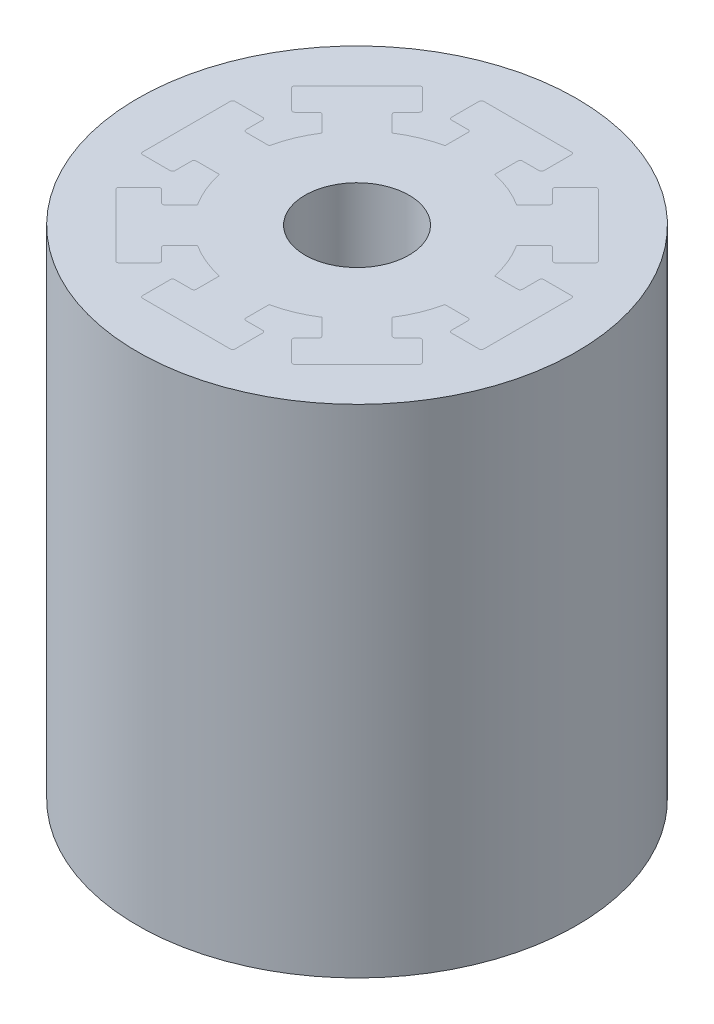
from build123d import *

# Parameters (mm, degrees)
SKETCH1_R           = 4.5
BOSS_EXTRUDE1_DEPTH = 43
SKETCH2_R           = 19
BOSS_EXTRUDE2_DEPTH = 43


with BuildPart() as part:
    # Sketch1 → Boss-Extrude1 (new body)
    with BuildSketch(Plane(origin=(0, 0, 0), x_dir=(1, 0, 0), z_dir=(0, 1, 0))):
        with BuildLine():
            Line((-2.15, 11.766140486), (-2.15, 9.766140486))
            ThreePointArc((-2.15, 9.766140486), (-3.826834324, 9.238795325), (-5.385424584, 8.425983744))
            Line((-5.385424584, 8.425983744), (-6.799638147, 9.840197306))
            ThreePointArc((-6.799638147, 9.840197306), (-6.858216791, 9.981618662), (-6.799638147, 10.123040018))
            Line((-6.799638147, 10.123040018), (-5.774333314, 11.148344851))
            ThreePointArc((-5.774333314, 11.148344851), (-5.71575467, 11.289766207), (-5.774333314, 11.431187564))
            Line((-5.774333314, 11.431187564), (-7.471389589, 13.128243838))
            ThreePointArc((-7.471389589, 13.128243838), (-7.612810945, 13.186822482), (-7.754232301, 13.128243838))
            Line((-7.754232301, 13.128243838), (-13.128243838, 7.754232301))
            ThreePointArc((-13.128243838, 7.754232301), (-13.186822482, 7.612810945), (-13.128243838, 7.471389589))
            Line((-13.128243838, 7.471389589), (-11.431187564, 5.774333314))
            ThreePointArc((-11.431187564, 5.774333314), (-11.289766207, 5.71575467), (-11.148344851, 5.774333314))
            Line((-11.148344851, 5.774333314), (-10.123040018, 6.799638147))
            ThreePointArc((-10.123040018, 6.799638147), (-9.981618662, 6.858216791), (-9.840197306, 6.799638147))
            Line((-9.840197306, 6.799638147), (-8.425983744, 5.385424584))
            ThreePointArc((-8.425983744, 5.385424584), (-9.238795325, 3.826834324), (-9.766140486, 2.15))
            Line((-9.766140486, 2.15), (-11.766140486, 2.15))
            ThreePointArc((-11.766140486, 2.15), (-11.907561843, 2.208578644), (-11.966140486, 2.35))
            Line((-11.966140486, 2.35), (-11.966140486, 3.8))
            ThreePointArc((-11.966140486, 3.8), (-12.02471913, 3.941421356), (-12.166140486, 4))
            Line((-12.166140486, 4), (-14.566140486, 4))
            ThreePointArc((-14.566140486, 4), (-14.707561843, 3.941421356), (-14.766140486, 3.8))
            Line((-14.766140486, 3.8), (-14.766140486, -3.8))
            ThreePointArc((-14.766140486, -3.8), (-14.707561843, -3.941421356), (-14.566140486, -4))
            Line((-14.566140486, -4), (-12.166140486, -4))
            ThreePointArc((-12.166140486, -4), (-12.02471913, -3.941421356), (-11.966140486, -3.8))
            Line((-11.966140486, -3.8), (-11.966140486, -2.35))
            ThreePointArc((-11.966140486, -2.35), (-11.907561843, -2.208578644), (-11.766140486, -2.15))
            Line((-11.766140486, -2.15), (-9.766140486, -2.15))
            ThreePointArc((-9.766140486, -2.15), (-9.238795325, -3.826834324), (-8.425983744, -5.385424584))
            Line((-8.425983744, -5.385424584), (-9.840197306, -6.799638147))
            ThreePointArc((-9.840197306, -6.799638147), (-9.981618662, -6.858216791), (-10.123040018, -6.799638147))
            Line((-10.123040018, -6.799638147), (-11.148344851, -5.774333314))
            ThreePointArc((-11.148344851, -5.774333314), (-11.289766207, -5.71575467), (-11.431187564, -5.774333314))
            Line((-11.431187564, -5.774333314), (-13.128243838, -7.471389589))
            ThreePointArc((-13.128243838, -7.471389589), (-13.186822482, -7.612810945), (-13.128243838, -7.754232301))
            Line((-13.128243838, -7.754232301), (-7.754232301, -13.128243838))
            ThreePointArc((-7.754232301, -13.128243838), (-7.612810945, -13.186822482), (-7.471389589, -13.128243838))
            Line((-7.471389589, -13.128243838), (-5.774333314, -11.431187564))
            ThreePointArc((-5.774333314, -11.431187564), (-5.71575467, -11.289766207), (-5.774333314, -11.148344851))
            Line((-5.774333314, -11.148344851), (-6.799638147, -10.123040018))
            ThreePointArc((-6.799638147, -10.123040018), (-6.858216791, -9.981618662), (-6.799638147, -9.840197306))
            Line((-6.799638147, -9.840197306), (-5.385424584, -8.425983744))
            ThreePointArc((-5.385424584, -8.425983744), (-3.826834324, -9.238795325), (-2.15, -9.766140486))
            Line((-2.15, -9.766140486), (-2.15, -11.766140486))
            ThreePointArc((-2.15, -11.766140486), (-2.208578644, -11.907561843), (-2.35, -11.966140486))
            Line((-2.35, -11.966140486), (-3.8, -11.966140486))
            ThreePointArc((-3.8, -11.966140486), (-3.941421356, -12.02471913), (-4, -12.166140486))
            Line((-4, -12.166140486), (-4, -14.566140486))
            ThreePointArc((-4, -14.566140486), (-3.941421356, -14.707561843), (-3.8, -14.766140486))
            Line((-3.8, -14.766140486), (3.8, -14.766140486))
            ThreePointArc((3.8, -14.766140486), (3.941421356, -14.707561843), (4, -14.566140486))
            Line((4, -14.566140486), (4, -12.166140486))
            ThreePointArc((4, -12.166140486), (3.941421356, -12.02471913), (3.8, -11.966140486))
            Line((3.8, -11.966140486), (2.35, -11.966140486))
            ThreePointArc((2.35, -11.966140486), (2.208578644, -11.907561843), (2.15, -11.766140486))
            Line((2.15, -11.766140486), (2.15, -9.766140486))
            ThreePointArc((2.15, -9.766140486), (3.826834324, -9.238795325), (5.385424584, -8.425983744))
            Line((5.385424584, -8.425983744), (6.799638147, -9.840197306))
            ThreePointArc((6.799638147, -9.840197306), (6.858216791, -9.981618662), (6.799638147, -10.123040018))
            Line((6.799638147, -10.123040018), (5.774333314, -11.148344851))
            ThreePointArc((5.774333314, -11.148344851), (5.71575467, -11.289766207), (5.774333314, -11.431187564))
            Line((5.774333314, -11.431187564), (7.471389589, -13.128243838))
            ThreePointArc((7.471389589, -13.128243838), (7.612810945, -13.186822482), (7.754232301, -13.128243838))
            Line((7.754232301, -13.128243838), (13.128243838, -7.754232301))
            ThreePointArc((13.128243838, -7.754232301), (13.186822482, -7.612810945), (13.128243838, -7.471389589))
            Line((13.128243838, -7.471389589), (11.431187564, -5.774333314))
            ThreePointArc((11.431187564, -5.774333314), (11.289766207, -5.71575467), (11.148344851, -5.774333314))
            Line((11.148344851, -5.774333314), (10.123040018, -6.799638147))
            ThreePointArc((10.123040018, -6.799638147), (9.981618662, -6.858216791), (9.840197306, -6.799638147))
            Line((9.840197306, -6.799638147), (8.425983744, -5.385424584))
            ThreePointArc((8.425983744, -5.385424584), (9.238795325, -3.826834324), (9.766140486, -2.15))
            Line((9.766140486, -2.15), (11.766140486, -2.15))
            ThreePointArc((11.766140486, -2.15), (11.907561843, -2.208578644), (11.966140486, -2.35))
            Line((11.966140486, -2.35), (11.966140486, -3.8))
            ThreePointArc((11.966140486, -3.8), (12.02471913, -3.941421356), (12.166140486, -4))
            Line((12.166140486, -4), (14.566140486, -4))
            ThreePointArc((14.566140486, -4), (14.707561843, -3.941421356), (14.766140486, -3.8))
            Line((14.766140486, -3.8), (14.766140486, 3.8))
            ThreePointArc((14.766140486, 3.8), (14.707561843, 3.941421356), (14.566140486, 4))
            Line((14.566140486, 4), (12.166140486, 4))
            ThreePointArc((12.166140486, 4), (12.02471913, 3.941421356), (11.966140486, 3.8))
            Line((11.966140486, 3.8), (11.966140486, 2.35))
            ThreePointArc((11.966140486, 2.35), (11.907561843, 2.208578644), (11.766140486, 2.15))
            Line((11.766140486, 2.15), (9.766140486, 2.15))
            ThreePointArc((9.766140486, 2.15), (9.238795325, 3.826834324), (8.425983744, 5.385424584))
            Line((8.425983744, 5.385424584), (9.840197306, 6.799638147))
            ThreePointArc((9.840197306, 6.799638147), (9.981618662, 6.858216791), (10.123040018, 6.799638147))
            Line((10.123040018, 6.799638147), (11.148344851, 5.774333314))
            ThreePointArc((11.148344851, 5.774333314), (11.289766207, 5.71575467), (11.431187564, 5.774333314))
            Line((11.431187564, 5.774333314), (13.128243838, 7.471389589))
            ThreePointArc((13.128243838, 7.471389589), (13.186822482, 7.612810945), (13.128243838, 7.754232301))
            Line((13.128243838, 7.754232301), (7.754232301, 13.128243838))
            ThreePointArc((7.754232301, 13.128243838), (7.612810945, 13.186822482), (7.471389589, 13.128243838))
            Line((7.471389589, 13.128243838), (5.774333314, 11.431187564))
            ThreePointArc((5.774333314, 11.431187564), (5.71575467, 11.289766207), (5.774333314, 11.148344851))
            Line((5.774333314, 11.148344851), (6.799638147, 10.123040018))
            ThreePointArc((6.799638147, 10.123040018), (6.858216791, 9.981618662), (6.799638147, 9.840197306))
            Line((6.799638147, 9.840197306), (5.385424584, 8.425983744))
            ThreePointArc((5.385424584, 8.425983744), (3.826834324, 9.238795325), (2.15, 9.766140486))
            Line((2.15, 9.766140486), (2.15, 11.766140486))
            ThreePointArc((2.15, 11.766140486), (2.208578644, 11.907561843), (2.35, 11.966140486))
            Line((2.35, 11.966140486), (3.8, 11.966140486))
            ThreePointArc((3.8, 11.966140486), (3.941421356, 12.02471913), (4, 12.166140486))
            Line((4, 12.166140486), (4, 14.566140486))
            ThreePointArc((4, 14.566140486), (3.941421356, 14.707561843), (3.8, 14.766140486))
            Line((3.8, 14.766140486), (-3.8, 14.766140486))
            ThreePointArc((-3.8, 14.766140486), (-3.941421356, 14.707561843), (-4, 14.566140486))
            Line((-4, 14.566140486), (-4, 12.166140486))
            ThreePointArc((-4, 12.166140486), (-3.941421356, 12.02471913), (-3.8, 11.966140486))
            Line((-3.8, 11.966140486), (-2.35, 11.966140486))
            ThreePointArc((-2.35, 11.966140486), (-2.208578644, 11.907561843), (-2.15, 11.766140486))
        make_face()
        with Locations(Location((0, 0, 0), (0, 0, 270))):
            Circle(SKETCH1_R, mode=Mode.SUBTRACT)
    extrude(amount=BOSS_EXTRUDE1_DEPTH)


with BuildPart() as body_2:
    # Sketch2 → Boss-Extrude2 (new body)
    with BuildSketch(Plane.XZ):
        with Locations(Location((0, 0, 0), (0, 0, 270))):
            Circle(SKETCH2_R)
        with BuildLine():
            Line((-2.35, -11.966140486), (-3.8, -11.966140486))
            ThreePointArc((-3.8, -11.966140486), (-3.941421356, -12.02471913), (-4, -12.166140486))
            Line((-4, -12.166140486), (-4, -14.566140486))
            ThreePointArc((-4, -14.566140486), (-3.941421356, -14.707561843), (-3.8, -14.766140486))
            Line((-3.8, -14.766140486), (3.8, -14.766140486))
            ThreePointArc((3.8, -14.766140486), (3.941421356, -14.707561843), (4, -14.566140486))
            Line((4, -14.566140486), (4, -12.166140486))
            ThreePointArc((4, -12.166140486), (3.941421356, -12.02471913), (3.8, -11.966140486))
            Line((3.8, -11.966140486), (2.35, -11.966140486))
            ThreePointArc((2.35, -11.966140486), (2.208578644, -11.907561843), (2.15, -11.766140486))
            Line((2.15, -11.766140486), (2.15, -9.766140486))
            ThreePointArc((2.15, -9.766140486), (3.826834324, -9.238795325), (5.385424584, -8.425983744))
            Line((5.385424584, -8.425983744), (6.799638147, -9.840197306))
            ThreePointArc((6.799638147, -9.840197306), (6.858216791, -9.981618662), (6.799638147, -10.123040018))
            Line((6.799638147, -10.123040018), (5.774333314, -11.148344851))
            ThreePointArc((5.774333314, -11.148344851), (5.71575467, -11.289766207), (5.774333314, -11.431187564))
            Line((5.774333314, -11.431187564), (7.471389589, -13.128243838))
            ThreePointArc((7.471389589, -13.128243838), (7.612810945, -13.186822482), (7.754232301, -13.128243838))
            Line((7.754232301, -13.128243838), (13.128243838, -7.754232301))
            ThreePointArc((13.128243838, -7.754232301), (13.186822482, -7.612810945), (13.128243838, -7.471389589))
            Line((13.128243838, -7.471389589), (11.431187564, -5.774333314))
            ThreePointArc((11.431187564, -5.774333314), (11.289766207, -5.71575467), (11.148344851, -5.774333314))
            Line((11.148344851, -5.774333314), (10.123040018, -6.799638147))
            ThreePointArc((10.123040018, -6.799638147), (9.981618662, -6.858216791), (9.840197306, -6.799638147))
            Line((9.840197306, -6.799638147), (8.425983744, -5.385424584))
            ThreePointArc((8.425983744, -5.385424584), (9.238795325, -3.826834324), (9.766140486, -2.15))
            Line((9.766140486, -2.15), (11.766140486, -2.15))
            ThreePointArc((11.766140486, -2.15), (11.907561843, -2.208578644), (11.966140486, -2.35))
            Line((11.966140486, -2.35), (11.966140486, -3.8))
            ThreePointArc((11.966140486, -3.8), (12.02471913, -3.941421356), (12.166140486, -4))
            Line((12.166140486, -4), (14.566140486, -4))
            ThreePointArc((14.566140486, -4), (14.707561843, -3.941421356), (14.766140486, -3.8))
            Line((14.766140486, -3.8), (14.766140486, 3.8))
            ThreePointArc((14.766140486, 3.8), (14.707561843, 3.941421356), (14.566140486, 4))
            Line((14.566140486, 4), (12.166140486, 4))
            ThreePointArc((12.166140486, 4), (12.02471913, 3.941421356), (11.966140486, 3.8))
            Line((11.966140486, 3.8), (11.966140486, 2.35))
            ThreePointArc((11.966140486, 2.35), (11.907561843, 2.208578644), (11.766140486, 2.15))
            Line((11.766140486, 2.15), (9.766140486, 2.15))
            ThreePointArc((9.766140486, 2.15), (9.238795325, 3.826834324), (8.425983744, 5.385424584))
            Line((8.425983744, 5.385424584), (9.840197306, 6.799638147))
            ThreePointArc((9.840197306, 6.799638147), (9.981618662, 6.858216791), (10.123040018, 6.799638147))
            Line((10.123040018, 6.799638147), (11.148344851, 5.774333314))
            ThreePointArc((11.148344851, 5.774333314), (11.289766207, 5.71575467), (11.431187564, 5.774333314))
            Line((11.431187564, 5.774333314), (13.128243838, 7.471389589))
            ThreePointArc((13.128243838, 7.471389589), (13.186822482, 7.612810945), (13.128243838, 7.754232301))
            Line((13.128243838, 7.754232301), (7.754232301, 13.128243838))
            ThreePointArc((7.754232301, 13.128243838), (7.612810945, 13.186822482), (7.471389589, 13.128243838))
            Line((7.471389589, 13.128243838), (5.774333314, 11.431187564))
            ThreePointArc((5.774333314, 11.431187564), (5.71575467, 11.289766207), (5.774333314, 11.148344851))
            Line((5.774333314, 11.148344851), (6.799638147, 10.123040018))
            ThreePointArc((6.799638147, 10.123040018), (6.858216791, 9.981618662), (6.799638147, 9.840197306))
            Line((6.799638147, 9.840197306), (5.385424584, 8.425983744))
            ThreePointArc((5.385424584, 8.425983744), (3.826834324, 9.238795325), (2.15, 9.766140486))
            Line((2.15, 9.766140486), (2.15, 11.766140486))
            ThreePointArc((2.15, 11.766140486), (2.208578644, 11.907561843), (2.35, 11.966140486))
            Line((2.35, 11.966140486), (3.8, 11.966140486))
            ThreePointArc((3.8, 11.966140486), (3.941421356, 12.02471913), (4, 12.166140486))
            Line((4, 12.166140486), (4, 14.566140486))
            ThreePointArc((4, 14.566140486), (3.941421356, 14.707561843), (3.8, 14.766140486))
            Line((3.8, 14.766140486), (-3.8, 14.766140486))
            ThreePointArc((-3.8, 14.766140486), (-3.941421356, 14.707561843), (-4, 14.566140486))
            Line((-4, 14.566140486), (-4, 12.166140486))
            ThreePointArc((-4, 12.166140486), (-3.941421356, 12.02471913), (-3.8, 11.966140486))
            Line((-3.8, 11.966140486), (-2.35, 11.966140486))
            ThreePointArc((-2.35, 11.966140486), (-2.208578644, 11.907561843), (-2.15, 11.766140486))
            Line((-2.15, 11.766140486), (-2.15, 9.766140486))
            ThreePointArc((-2.15, 9.766140486), (-3.826834324, 9.238795325), (-5.385424584, 8.425983744))
            Line((-5.385424584, 8.425983744), (-6.799638147, 9.840197306))
            ThreePointArc((-6.799638147, 9.840197306), (-6.858216791, 9.981618662), (-6.799638147, 10.123040018))
            Line((-6.799638147, 10.123040018), (-5.774333314, 11.148344851))
            ThreePointArc((-5.774333314, 11.148344851), (-5.71575467, 11.289766207), (-5.774333314, 11.431187564))
            Line((-5.774333314, 11.431187564), (-7.471389589, 13.128243838))
            ThreePointArc((-7.471389589, 13.128243838), (-7.612810945, 13.186822482), (-7.754232301, 13.128243838))
            Line((-7.754232301, 13.128243838), (-13.128243838, 7.754232301))
            ThreePointArc((-13.128243838, 7.754232301), (-13.186822482, 7.612810945), (-13.128243838, 7.471389589))
            Line((-13.128243838, 7.471389589), (-11.431187564, 5.774333314))
            ThreePointArc((-11.431187564, 5.774333314), (-11.289766207, 5.71575467), (-11.148344851, 5.774333314))
            Line((-11.148344851, 5.774333314), (-10.123040018, 6.799638147))
            ThreePointArc((-10.123040018, 6.799638147), (-9.981618662, 6.858216791), (-9.840197306, 6.799638147))
            Line((-9.840197306, 6.799638147), (-8.425983744, 5.385424584))
            ThreePointArc((-8.425983744, 5.385424584), (-9.238795325, 3.826834324), (-9.766140486, 2.15))
            Line((-9.766140486, 2.15), (-11.766140486, 2.15))
            ThreePointArc((-11.766140486, 2.15), (-11.907561843, 2.208578644), (-11.966140486, 2.35))
            Line((-11.966140486, 2.35), (-11.966140486, 3.8))
            ThreePointArc((-11.966140486, 3.8), (-12.02471913, 3.941421356), (-12.166140486, 4))
            Line((-12.166140486, 4), (-14.566140486, 4))
            ThreePointArc((-14.566140486, 4), (-14.707561843, 3.941421356), (-14.766140486, 3.8))
            Line((-14.766140486, 3.8), (-14.766140486, -3.8))
            ThreePointArc((-14.766140486, -3.8), (-14.707561843, -3.941421356), (-14.566140486, -4))
            Line((-14.566140486, -4), (-12.166140486, -4))
            ThreePointArc((-12.166140486, -4), (-12.02471913, -3.941421356), (-11.966140486, -3.8))
            Line((-11.966140486, -3.8), (-11.966140486, -2.35))
            ThreePointArc((-11.966140486, -2.35), (-11.907561843, -2.208578644), (-11.766140486, -2.15))
            Line((-11.766140486, -2.15), (-9.766140486, -2.15))
            ThreePointArc((-9.766140486, -2.15), (-9.238795325, -3.826834324), (-8.425983744, -5.385424584))
            Line((-8.425983744, -5.385424584), (-9.840197306, -6.799638147))
            ThreePointArc((-9.840197306, -6.799638147), (-9.981618662, -6.858216791), (-10.123040018, -6.799638147))
            Line((-10.123040018, -6.799638147), (-11.148344851, -5.774333314))
            ThreePointArc((-11.148344851, -5.774333314), (-11.289766207, -5.71575467), (-11.431187564, -5.774333314))
            Line((-11.431187564, -5.774333314), (-13.128243838, -7.471389589))
            ThreePointArc((-13.128243838, -7.471389589), (-13.186822482, -7.612810945), (-13.128243838, -7.754232301))
            Line((-13.128243838, -7.754232301), (-7.754232301, -13.128243838))
            ThreePointArc((-7.754232301, -13.128243838), (-7.612810945, -13.186822482), (-7.471389589, -13.128243838))
            Line((-7.471389589, -13.128243838), (-5.774333314, -11.431187564))
            ThreePointArc((-5.774333314, -11.431187564), (-5.71575467, -11.289766207), (-5.774333314, -11.148344851))
            Line((-5.774333314, -11.148344851), (-6.799638147, -10.123040018))
            ThreePointArc((-6.799638147, -10.123040018), (-6.858216791, -9.981618662), (-6.799638147, -9.840197306))
            Line((-6.799638147, -9.840197306), (-5.385424584, -8.425983744))
            ThreePointArc((-5.385424584, -8.425983744), (-3.826834324, -9.238795325), (-2.15, -9.766140486))
            Line((-2.15, -9.766140486), (-2.15, -11.766140486))
            ThreePointArc((-2.15, -11.766140486), (-2.208578644, -11.907561843), (-2.35, -11.966140486))
        make_face(mode=Mode.SUBTRACT)
    extrude(amount=-BOSS_EXTRUDE2_DEPTH)


solid = Compound([part.part, body_2.part])
